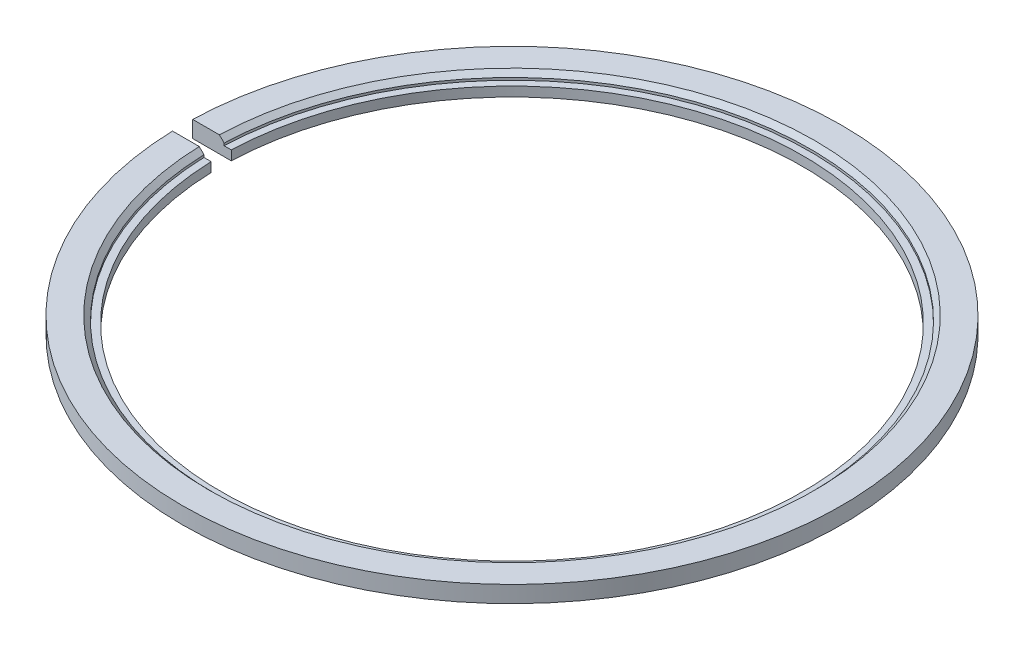
from build123d import *

# Parameters (mm, degrees)
INNER_CHAMFER_SIZE  = 0.508
SLIT_CUT_DEPTH      = 1.0795
SLIT_CUT_DEPTH_BACK = 1.0795
SLIT_SKETCH_W       = 25.449079392
SLIT_SKETCH_H       = 3.3923794


with BuildPart() as part:
    # Primary Sketch → Primary Revolve (revolve)
    with BuildSketch(Plane.XY):
        Polygon((4.1275, 1.778), (4.1275, 0), (0, 0), (0, 1.016), (0.762, 1.016), (0.762, 1.778), align=None)
    revolve(axis=Axis((-31.115, 0, 0), (0, 1, 0)))

    # Inner Chamfer
    inner_chamfer_edges = [part.edges().sort_by_distance(p)[0] for p in [
        (-62.992, 1.778, 0),
    ]]
    chamfer(inner_chamfer_edges, length=INNER_CHAMFER_SIZE)

    # Slit Sketch → Slit Cut (cut, two sides: drawn at the far end of the back side and taken through both)
    with BuildSketch(Plane.XY.offset(-SLIT_CUT_DEPTH_BACK)):
        with Locations((-62.246580084, 1.6961897)):
            Rectangle(SLIT_SKETCH_W, SLIT_SKETCH_H)
    extrude(amount=SLIT_CUT_DEPTH + SLIT_CUT_DEPTH_BACK, mode=Mode.SUBTRACT)


solid = part.part
